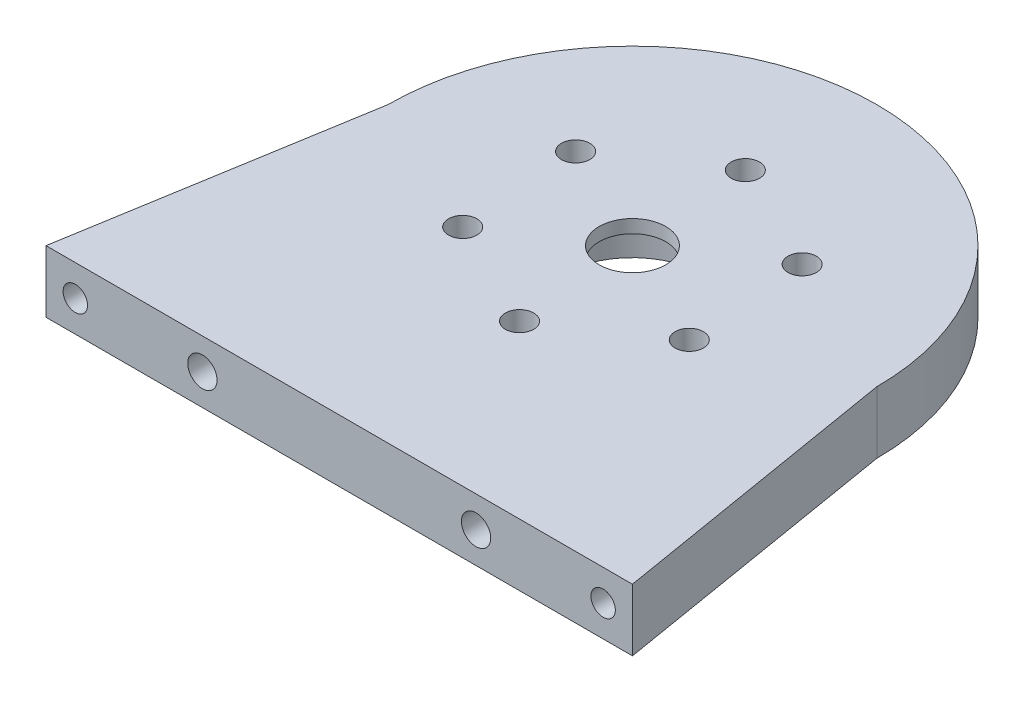
from build123d import *

# Parameters (mm, degrees)
PLACA_J5_START           = -3.175
PLACA_J5_DEPTH           = 6.35
PLACA_J5_REDONDEO_START  = -3.175
CROQUIS9_R               = 25
PLACA_J5_REDONDEO_DEPTH  = 6.35
BARRENOS_SALIDA_M5_START = -3.175
CROQUIS10_R              = 1.45
CROQUIS10_R_2            = 3.4
BARRENOS_SALIDA_M5_DEPTH = 6.35
REFRENTADO_M2_5_START    = -3.175
CROQUIS11_R              = 2.5
REFRENTADO_M2_5_DEPTH    = 2.6
ROSCA_M3_CANTO_START     = 357.55
CROQUIS12_R              = 1.25
ROSCA_M3_CANTO_DEPTH     = 9
PASADORES_D3_START       = 359.55
CROQUIS13_R              = 1.5
PASADORES_D3_DEPTH       = 7
CROQUIS14_R              = 7.475
CORTAR_EXTRUIR1_DEPTH    = 5


with BuildPart() as part:
    # Croquis8 → Placa_J5 (new body)
    with BuildSketch(Plane(origin=(0, 0, 0), x_dir=(1, 0, 0), z_dir=(0, 1, 0)).offset(PLACA_J5_START)):
        Polygon((127.4, -336.55), (177.4, -336.55), (182.4, -366.55), (122.4, -366.55), align=None)
    extrude(amount=PLACA_J5_DEPTH)

    # Croquis9 → Placa_J5_redondeo (add)
    with BuildSketch(Plane(origin=(0, 0, 0), x_dir=(1, 0, 0), z_dir=(0, 1, 0)).offset(PLACA_J5_REDONDEO_START)):
        with Locations((152.4, -336.55)):
            Circle(CROQUIS9_R)
    extrude(amount=PLACA_J5_REDONDEO_DEPTH)

    # Croquis10 → Barrenos_salida_M5 (cut)
    with BuildSketch(Plane(origin=(0, 0, 0), x_dir=(1, 0, 0), z_dir=(0, 1, 0)).offset(BARRENOS_SALIDA_M5_START)):
        with Locations((163.653984643, -341.990388742)):
            Circle(CROQUIS10_R)
        with Locations((153.315477464, -349.016430965)):
            Circle(CROQUIS10_R)
        with Locations((142.061492822, -343.576042223)):
            Circle(CROQUIS10_R)
        with Locations((141.146015357, -331.109611258)):
            Circle(CROQUIS10_R)
        with Locations((151.484522536, -324.083569035)):
            Circle(CROQUIS10_R)
        with Locations((162.738507178, -329.523957777)):
            Circle(CROQUIS10_R)
        with Locations((152.4, -336.55)):
            Circle(CROQUIS10_R_2)
    extrude(amount=BARRENOS_SALIDA_M5_DEPTH, mode=Mode.SUBTRACT)

    # Croquis11 → Refrentado_M2-5 (cut)
    with BuildSketch(Plane(origin=(0, 0, 0), x_dir=(1, 0, 0), z_dir=(0, 1, 0)).offset(REFRENTADO_M2_5_START)):
        with Locations((163.653984643, -341.990388742)):
            Circle(CROQUIS11_R)
        with Locations((153.315477464, -349.016430965)):
            Circle(CROQUIS11_R)
        with Locations((142.061492822, -343.576042223)):
            Circle(CROQUIS11_R)
        with Locations((141.146015357, -331.109611258)):
            Circle(CROQUIS11_R)
        with Locations((151.484522536, -324.083569035)):
            Circle(CROQUIS11_R)
        with Locations((162.738507178, -329.523957777)):
            Circle(CROQUIS11_R)
    extrude(amount=REFRENTADO_M2_5_DEPTH, mode=Mode.SUBTRACT)

    # Croquis12 → Rosca_M3_canto (cut)
    with BuildSketch(Plane.XY.offset(ROSCA_M3_CANTO_START)):
        with Locations((125.4, 0)):
            Circle(CROQUIS12_R)
        with Locations((179.4, 0)):
            Circle(CROQUIS12_R)
    extrude(amount=ROSCA_M3_CANTO_DEPTH, mode=Mode.SUBTRACT)

    # Croquis13 → Pasadores_D3 (cut)
    with BuildSketch(Plane.XY.offset(PASADORES_D3_START)):
        with Locations((138.4, 0)):
            Circle(CROQUIS13_R)
        with Locations((166.4, 0)):
            Circle(CROQUIS13_R)
    extrude(amount=PASADORES_D3_DEPTH, mode=Mode.SUBTRACT)

    # Croquis14 → Cortar-Extruir1 (cut)
    with BuildSketch(Plane.XZ.offset(3.175)):
        with Locations((152.4, 336.55)):
            Circle(CROQUIS14_R)
    extrude(amount=-CORTAR_EXTRUIR1_DEPTH, mode=Mode.SUBTRACT)


solid = part.part
